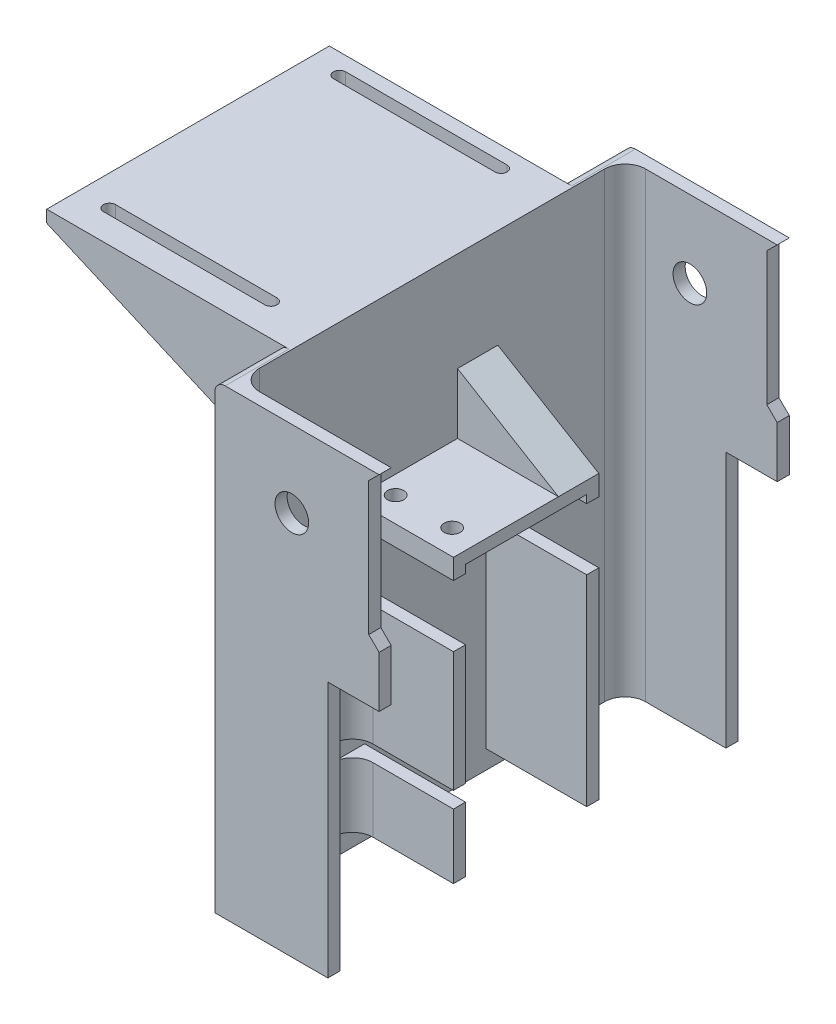
from build123d import *

# Parameters (mm, degrees)
BOSS_EXTRUDE1_DEPTH      = 101.6
SKETCH2_R                = 4.1656
CUT_EXTRUDE1_DEPTH       = 141.047212542
SKETCH3_W                = 45.3392611
SKETCH3_H                = 95.6
CUT_EXTRUDE2_DEPTH       = 164.328230385
SKETCH5_W                = 36
SKETCH5_H                = 70
BOSS_EXTRUDE2_DEPTH      = 25
CUT_EXTRUDE3_DEPTH       = 25
FILLET1_R                = 5.08
SKETCH7_R                = 2
CUT_EXTRUDE4_DEPTH       = 139.536371578
CUT_EXTRUDE5_DEPTH       = 7.488
CUT_EXTRUDE5_DEPTH_BACK  = 44.572
SKETCH8_W                = 30.464500282
SKETCH8_H                = 15.24
BOSS_EXTRUDE3_DEPTH      = 10
BOSS_EXTRUDE4_DEPTH      = 35
BOSS_EXTRUDE4_DEPTH_BACK = 35
SKETCH11_W               = 60
SKETCH11_H               = 3
BOSS_EXTRUDE5_DEPTH      = 3
CUT_EXTRUDE6_DEPTH       = 190.450951053


with BuildPart() as part:
    # Sketch1 → Boss-Extrude1 (new body)
    with BuildSketch(Plane(origin=(0, 0, 0), x_dir=(-1, 0, 0), z_dir=(0, 0, 1))):
        with BuildLine():
            Line((57.350334268, 77.47), (29.380183448, 77.47))
            Line((29.380183448, 77.47), (29.380183448, 13.97))
            Line((29.380183448, 13.97), (16.680183448, 13.97))
            Line((16.680183448, 13.97), (16.680183448, 1.27))
            Line((16.680183448, 1.27), (19.250334268, -1.27))
            Line((19.250334268, -1.27), (19.250334268, -34.29))
            Line((19.250334268, -34.29), (16.6878, -36.83))
            Line((16.6878, -36.83), (54.810334268, -36.83))
            ThreePointArc((54.810334268, -36.83), (56.606385492, -36.086051224), (57.350334268, -34.29))
            Line((57.350334268, -34.29), (57.350334268, 77.47))
        make_face()
    extrude(amount=BOSS_EXTRUDE1_DEPTH)

    # Sketch2 → Cut-Extrude1 (cut, through all)
    with BuildSketch(Plane.XY.offset(101.6)):
        with Locations((-38.300334268, 17.78)):
            Circle(SKETCH2_R)
    extrude(amount=-CUT_EXTRUDE1_DEPTH, mode=Mode.SUBTRACT)

    # Sketch3 → Cut-Extrude2 (cut, through all)
    with BuildSketch(Plane(origin=(0, -77.47, 0), x_dir=(-1, 0, 0), z_dir=(0, -1, 0))):
        with Locations((31.680703718, -50.8)):
            Rectangle(SKETCH3_W, SKETCH3_H)
    extrude(amount=-CUT_EXTRUDE2_DEPTH, mode=Mode.SUBTRACT)

    # Sketch5 → Boss-Extrude2 (add)
    with BuildSketch(Plane(origin=(-54.350334268, 0, 0), x_dir=(0, 0, -1), z_dir=(1, 0, 0))):
        with Locations((-52.512822265, -37.765880907)):
            Rectangle(SKETCH5_W, SKETCH5_H)
    extrude(amount=BOSS_EXTRUDE2_DEPTH)

    # Sketch6 → Cut-Extrude3 (cut)
    with BuildSketch(Plane(origin=(-29.350334268, 0, 0), x_dir=(0, 0, -1), z_dir=(1, 0, 0))):
        Polygon((-67.512822265, -5.765880907), (-37.512822265, -5.765880907), (-37.512822265, -85.765880907), (-67.512822265, -85.765880907), (-67.512822265, -56.765880907), (-78.412691352, -56.765880907), (-78.412691352, -52.765880907), (-67.512822265, -52.765880907), align=None)
    extrude(amount=-CUT_EXTRUDE3_DEPTH, mode=Mode.SUBTRACT)

    # Fillet1
    fillet1_edges = [part.edges().sort_by_distance(p)[0] for p in [
        (-54.350334268, -20.32, 98.6),
        (-54.350334268, -20.32, 3),
        (-54.350334268, -37.765880907, 34.512822265),
        (-54.350334268, -27.765880907, 70.512822265),
        (-54.350334268, -64.765880907, 70.512822265),
    ]]
    fillet(fillet1_edges, radius=FILLET1_R)

    # Sketch7 → Cut-Extrude4 (cut, through all)
    with BuildSketch(Plane(origin=(0, -2.765880907, 0), x_dir=(1, 0, 0), z_dir=(0, 1, 0))):
        with Locations(Location((-49.850334378, -64.332963641, 0), (0, 0, 180))):
            Circle(SKETCH7_R)
        with Locations(Location((-35.854934378, -64.332963641, 0), (0, 0, 180))):
            Circle(SKETCH7_R)
    extrude(amount=-CUT_EXTRUDE4_DEPTH, mode=Mode.SUBTRACT)

    # Sketch8 → Cut-Extrude5 (cut, two sides: drawn at the far end of the back side and taken through both)
    with BuildSketch(Plane(origin=(0, 0, 34.512822265), x_dir=(-1, 0, 0), z_dir=(0, 0, -1)).offset(-CUT_EXTRUDE5_DEPTH_BACK)):
        with Locations((39.118084127, -15.385880813)):
            Rectangle(SKETCH8_W, SKETCH8_H)
    extrude(amount=CUT_EXTRUDE5_DEPTH + CUT_EXTRUDE5_DEPTH_BACK, mode=Mode.SUBTRACT)

    # Sketch9 → Boss-Extrude3 (add)
    with BuildSketch(Plane(origin=(0, 0, 34.512822265), x_dir=(-1, 0, 0), z_dir=(0, 0, -1))):
        Polygon((29.350334268, -2.765880907), (54.350334268, -2.765880907), (54.350334268, 12.234119093), align=None)
    extrude(amount=-BOSS_EXTRUDE3_DEPTH)

    # Sketch11 → Boss-Extrude4 (add, two sides: drawn at the far end of the back side and taken through both)
    with BuildSketch(Plane.XY.offset(50.8).offset(-BOSS_EXTRUDE4_DEPTH_BACK)):
        with Locations((-84.810334268, 35.33)):
            Rectangle(SKETCH11_W, SKETCH11_H)
    extrude(amount=BOSS_EXTRUDE4_DEPTH + BOSS_EXTRUDE4_DEPTH_BACK)

    # Sketch12 → Boss-Extrude5 (add)
    with BuildSketch(Plane.XY.offset(85.8)):
        Polygon((-114.810334268, 33.83), (-57.350334268, 33.83), (-57.350334268, 8.83), align=None)
    extrude(amount=-BOSS_EXTRUDE5_DEPTH)

    # Sketch13 → Cut-Extrude6 (cut, through all)
    with BuildSketch(Plane(origin=(0, 33.83, 0), x_dir=(-1, 0, 0), z_dir=(0, -1, 0))):
        with BuildLine():
            Line((107.269485022, -79.300000094), (67.264485022, -79.300000094))
            ThreePointArc((67.264485022, -79.300000094), (65.764485022, -77.800000094), (67.264485022, -76.300000094))
            Line((67.264485022, -76.300000094), (107.269485022, -76.300000094))
            ThreePointArc((107.269485022, -76.300000094), (108.769485022, -77.800000094), (107.269485022, -79.300000094))
        make_face()
        with BuildLine():
            Line((107.269485022, -22.302400094), (67.264485022, -22.302400094))
            ThreePointArc((67.264485022, -22.302400094), (65.764485022, -20.802400094), (67.264485022, -19.302400094))
            Line((67.264485022, -19.302400094), (107.269485022, -19.302400094))
            ThreePointArc((107.269485022, -19.302400094), (108.769485022, -20.802400094), (107.269485022, -22.302400094))
        make_face()
    extrude(amount=-CUT_EXTRUDE6_DEPTH, mode=Mode.SUBTRACT)


solid = part.part
